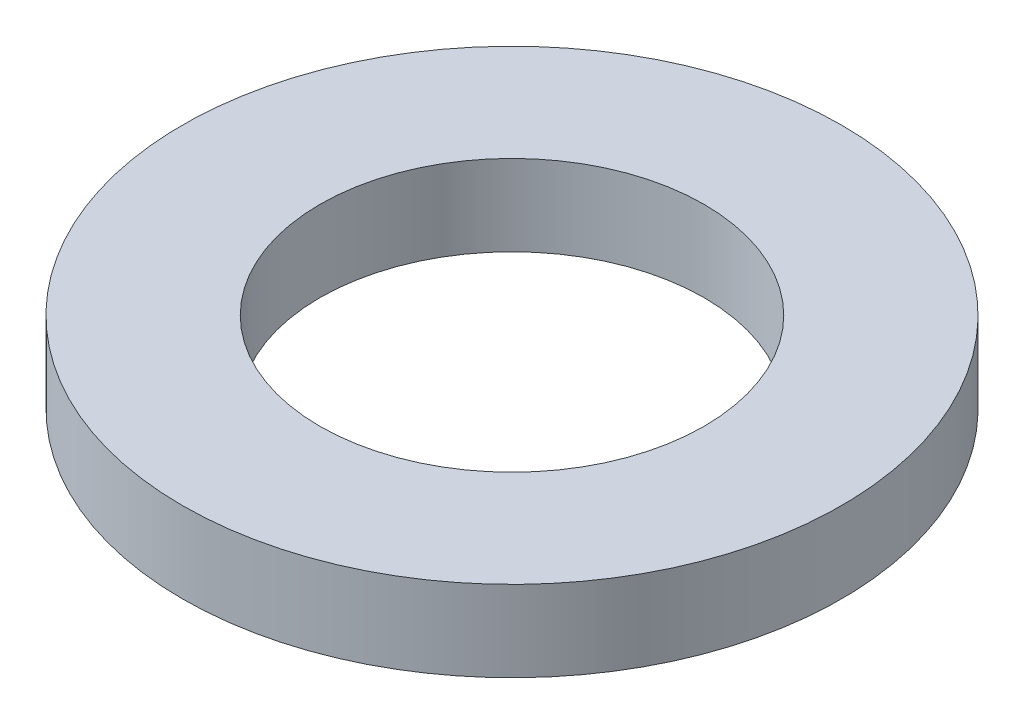
from build123d import *

# Parameters (mm, degrees)
SKETCH1_R           = 7.14375
BOSS_EXTRUDE1_DEPTH = 1.7526
SKETCH5_R           = 4.1656
CUT_EXTRUDE1_DEPTH  = 11.25367909


with BuildPart() as part:
    # Sketch1 → Boss-Extrude1 (new body)
    with BuildSketch(Plane(origin=(0, 0, 0), x_dir=(1, 0, 0), z_dir=(0, 1, 0))):
        with Locations(Location((0, 0, 0), (0, 0, 270))):
            Circle(SKETCH1_R)
    extrude(amount=BOSS_EXTRUDE1_DEPTH)

    # Sketch5 → Cut-Extrude1 (cut, through all)
    with BuildSketch(Plane(origin=(0, 1.7526, 0), x_dir=(-1, 0, 0), z_dir=(0, 1, 0))):
        with Locations(Location((0, 0, 0), (0, 0, 90))):
            Circle(SKETCH5_R)
    extrude(amount=-CUT_EXTRUDE1_DEPTH, mode=Mode.SUBTRACT)


solid = part.part
